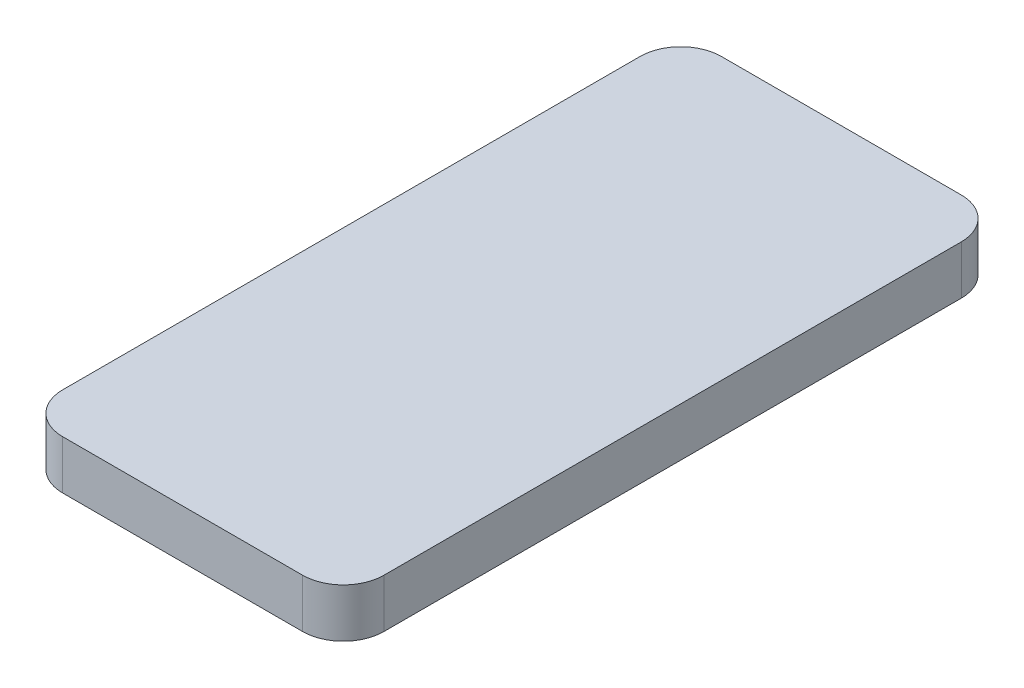
from build123d import *

# Parameters (mm, degrees)
SKETCH1_W           = 79
SKETCH1_H           = 162
BOSS_EXTRUDE1_DEPTH = 12
FILLET1_R           = 10


with BuildPart() as part:
    # Sketch1 → Boss-Extrude1 (new body)
    with BuildSketch(Plane(origin=(0, 0, 0), x_dir=(1, 0, 0), z_dir=(0, 1, 0))):
        Rectangle(SKETCH1_W, SKETCH1_H)
    extrude(amount=BOSS_EXTRUDE1_DEPTH)

    # Fillet1
    fillet1_edges = [part.edges().sort_by_distance(p)[0] for p in [
        (39.5, 6, 81),
        (-39.5, 6, 81),
        (-39.5, 6, -81),
        (39.5, 6, -81),
    ]]
    fillet(fillet1_edges, radius=FILLET1_R)


solid = part.part
